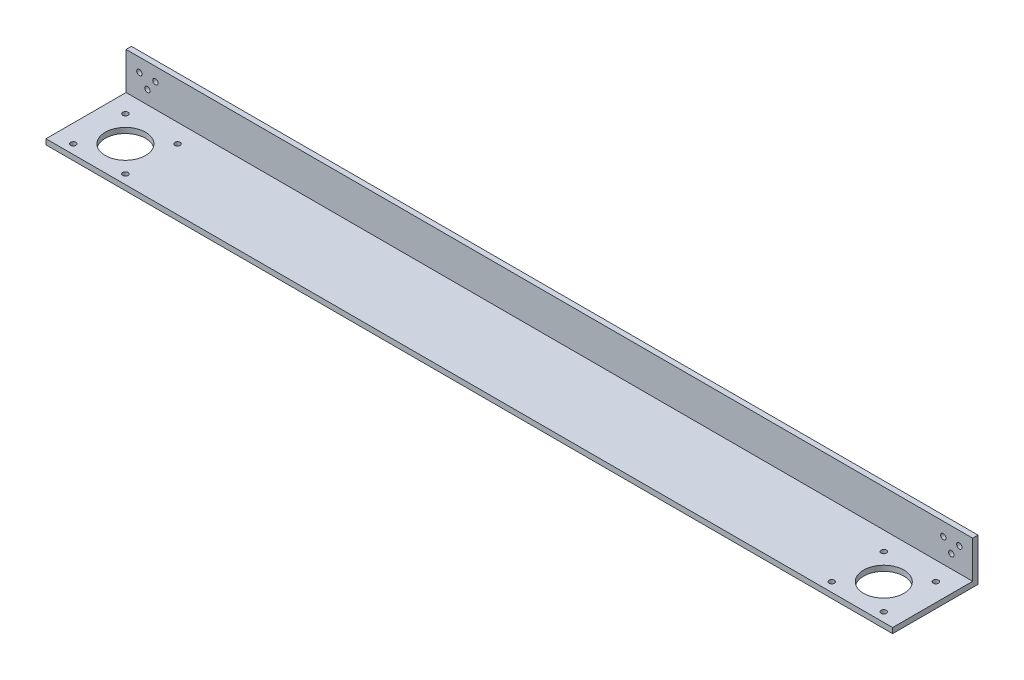
from build123d import *

# Parameters (mm, degrees)
BOSS_EXTRUDE1_DEPTH              = 503.65
TOPHOLES_SKETCH2_R               = 12
TOPHOLES_SKETCH2_R_2             = 1.5875
TOPHOLES_CUT_EXTRUDE1_DEPTH      = 507.693115332
BACKSIDEHOLES_SKETCH3_R          = 1.5875
BACKSIDEHOLES_CUT_EXTRUDE2_DEPTH = 507.842305357


with BuildPart() as part:
    # Sketch1 → Boss-Extrude1 (new body)
    with BuildSketch(Plane(origin=(0, 0, 0), x_dir=(0, 0, -1), z_dir=(1, 0, 0))):
        Polygon((0, 0), (-50.8, 0), (-50.8, 3.175), (-3.175, 3.175), (-3.175, 25.4), (0, 25.4), align=None)
    extrude(amount=BOSS_EXTRUDE1_DEPTH)

    # TopHoles-Sketch2 → TopHoles-Cut-Extrude1 (cut, through all)
    with BuildSketch(Plane(origin=(0, 3.175, 0), x_dir=(1, 0, 0), z_dir=(0, 1, 0))):
        with Locations(Location((26.25, -29.8, 0), (0, 0, 270))):
            Circle(TOPHOLES_SKETCH2_R)
        with Locations(Location((477.4, -29.8, 0), (0, 0, 270))):
            Circle(TOPHOLES_SKETCH2_R)
        with Locations(Location((10.75, -14.3, 0), (0, 0, 270))):
            Circle(TOPHOLES_SKETCH2_R_2)
        with Locations(Location((41.75, -14.3, 0), (0, 0, 270))):
            Circle(TOPHOLES_SKETCH2_R_2)
        with Locations(Location((461.9, -14.3, 0), (0, 0, 270))):
            Circle(TOPHOLES_SKETCH2_R_2)
        with Locations(Location((492.9, -14.3, 0), (0, 0, 270))):
            Circle(TOPHOLES_SKETCH2_R_2)
        with Locations(Location((10.75, -45.3, 0), (0, 0, 270))):
            Circle(TOPHOLES_SKETCH2_R_2)
        with Locations(Location((41.75, -45.3, 0), (0, 0, 270))):
            Circle(TOPHOLES_SKETCH2_R_2)
        with Locations(Location((461.9, -45.3, 0), (0, 0, 270))):
            Circle(TOPHOLES_SKETCH2_R_2)
        with Locations(Location((492.9, -45.3, 0), (0, 0, 270))):
            Circle(TOPHOLES_SKETCH2_R_2)
    extrude(amount=-TOPHOLES_CUT_EXTRUDE1_DEPTH, mode=Mode.SUBTRACT)

    # BackSideHoles-Sketch3 → BackSideHoles-Cut-Extrude2 (cut, through all)
    with BuildSketch(Plane(origin=(0, 0, 0), x_dir=(-1, 0, 0), z_dir=(0, 0, -1))):
        with Locations(Location((-495.7125, 17.4625, 0), (0, 0, 90))):
            Circle(BACKSIDEHOLES_SKETCH3_R)
        with Locations(Location((-486.1875, 17.4625, 0), (0, 0, 90))):
            Circle(BACKSIDEHOLES_SKETCH3_R)
        with Locations(Location((-490.95, 11.1125, 0), (0, 0, 90))):
            Circle(BACKSIDEHOLES_SKETCH3_R)
        with Locations(Location((-12.7, 11.1125, 0), (0, 0, 90))):
            Circle(BACKSIDEHOLES_SKETCH3_R)
        with Locations(Location((-17.4625, 17.4625, 0), (0, 0, 90))):
            Circle(BACKSIDEHOLES_SKETCH3_R)
        with Locations(Location((-7.9375, 17.4625, 0), (0, 0, 90))):
            Circle(BACKSIDEHOLES_SKETCH3_R)
    extrude(amount=-BACKSIDEHOLES_CUT_EXTRUDE2_DEPTH, mode=Mode.SUBTRACT)


solid = part.part
